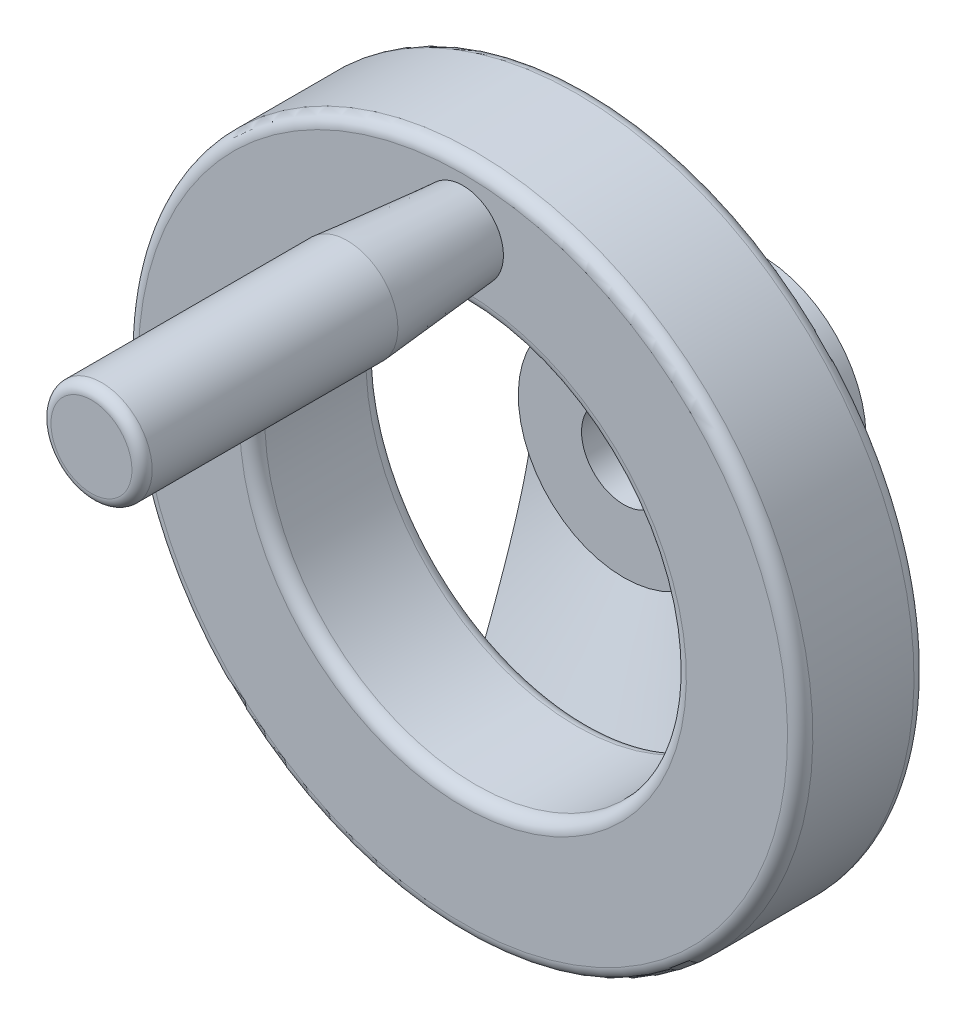
from build123d import *

# Parameters (mm, degrees)
CUT_EXTRUDE1_DEPTH = 85.69074446
FILLET1_R          = 1.524


with BuildPart() as part:
    # Sketch1 → Revolve1 (revolve)
    with BuildSketch(Plane(origin=(0, 0, 0), x_dir=(0, 0, -1), z_dir=(1, 0, 0))):
        with BuildLine():
            Line((-25.796875, -48.895), (-25.796875, -36.5125))
            Line((-25.796875, -36.5125), (-25.796875, -33.655))
            ThreePointArc((-25.796875, -33.655), (-26.354836582, -32.307961582), (-27.701875, -31.75))
            Line((-27.701875, -31.75), (-42.941875, -31.75))
            ThreePointArc((-42.941875, -31.75), (-44.288913418, -32.307961582), (-44.846875, -33.655))
            Line((-44.846875, -33.655), (-44.846875, -48.895))
            ThreePointArc((-44.846875, -48.895), (-44.288913418, -50.242038418), (-42.941875, -50.8))
            Line((-42.941875, -50.8), (-27.701875, -50.8))
            ThreePointArc((-27.701875, -50.8), (-26.354836582, -50.242038418), (-25.796875, -48.895))
        make_face()
    revolve(axis=Axis((0, 0, 0), (0, 0, 1)))


with BuildPart() as body_2:
    # Sketch1<3> → Revolve2 (revolve)
    with BuildSketch(Plane(origin=(0, 0, 0), x_dir=(0, 0, -1), z_dir=(1, 0, 0))):
        Polygon((0, -15.875), (0, -6.35), (-20.6375, -6.35), (-20.6375, -15.875), (-18.161, -15.875), (-25.796875, -33.655), (-25.796875, -36.5125), (-6.19125, -15.875), align=None)
    revolve(axis=Axis((0, 0, 0), (0, 0, 1)))

    # Sketch2 → Cut-Extrude1 (cut, through all)
    with BuildSketch(Plane.XY):
        with BuildLine():
            Line((-15.875, 48.255822188), (-15.875, -48.255822188))
            ThreePointArc((-15.875, -48.255822188), (-50.8, 0), (-15.875, 48.255822188))
        make_face()
        with BuildLine():
            Line((15.875, 48.255822188), (15.875, -48.255822188))
            ThreePointArc((15.875, -48.255822188), (50.8, 0), (15.875, 48.255822188))
        make_face()
    extrude(amount=CUT_EXTRUDE1_DEPTH, mode=Mode.SUBTRACT)


with BuildPart() as body_3:
    # Sketch4 → Revolve3 (revolve)
    with BuildSketch(Plane(origin=(0, 0, 0), x_dir=(0, 0, -1), z_dir=(1, 0, 0))):
        Polygon((-44.846875, 47.371), (-44.846875, 41.275), (-100.80625, 41.275), (-100.80625, 48.895), (-62.266274709, 48.895), align=None)
    revolve(axis=Axis((0, 41.275, 44.846875), (0, 0, -1)))

    # Fillet1
    fillet1_edges = [body_3.edges().sort_by_distance(p)[0] for p in [
        (0, 33.655, 100.80625),
    ]]
    fillet(fillet1_edges, radius=FILLET1_R)


solid = Compound([part.part, body_2.part, body_3.part])
